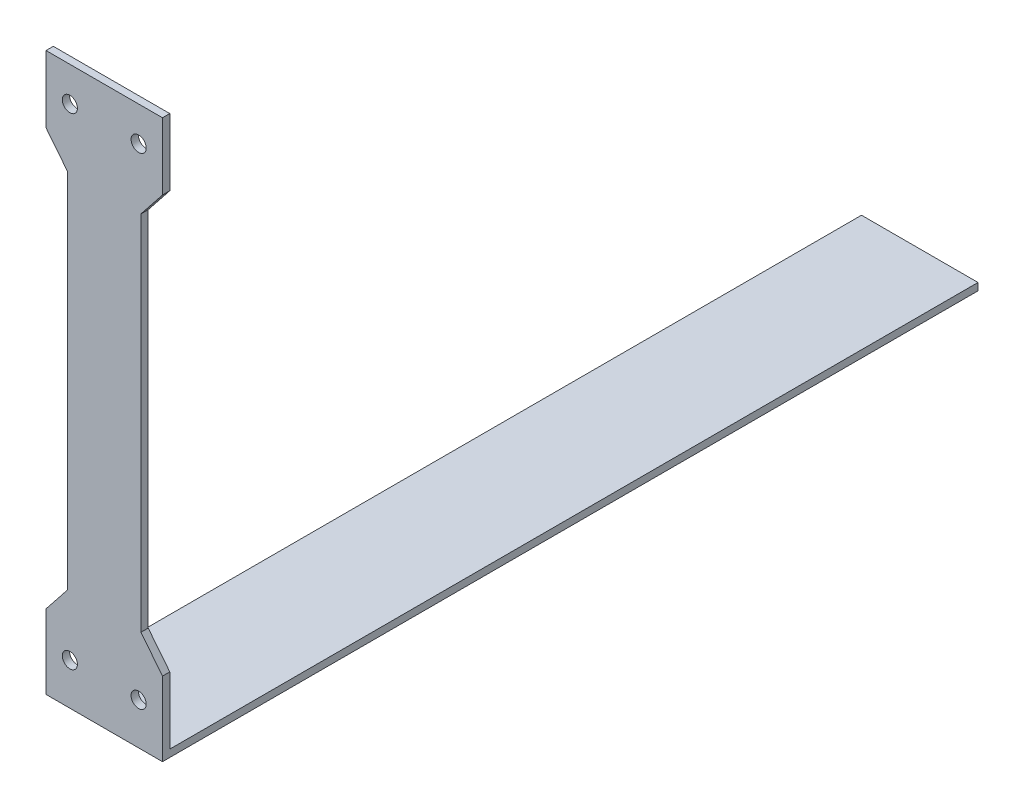
from build123d import *

# Parameters (mm, degrees)
BOSS_EXTRUDE1_DEPTH = 1.5875
SKETCH2_W           = 25.4
SKETCH2_H           = 177.8
BOSS_EXTRUDE2_DEPTH = 1.5875


with BuildPart() as part:
    # Sketch1 → Boss-Extrude1 (new body)
    with BuildSketch(Plane.XY):
        Polygon((-117, 20.5), (-117, 99.5), (-112.3, 105.418518519), (-112.3, 120), (-137.7, 120), (-137.7, 105.418518519), (-133, 99.5), (-133, 20.5), (-137.7, 14.581481481), (-137.7, 0), (-112.3, 0), (-112.3, 14.581481481), align=None)
        with BuildLine():
            ThreePointArc((-130.85, 7.5), (-132.5, 5.85), (-134.15, 7.5))
            ThreePointArc((-134.15, 7.5), (-132.5, 9.15), (-130.85, 7.5))
        make_face(mode=Mode.SUBTRACT)
        with BuildLine():
            ThreePointArc((-119.15, 7.5), (-117.5, 9.15), (-115.85, 7.5))
            ThreePointArc((-115.85, 7.5), (-117.5, 5.85), (-119.15, 7.5))
        make_face(mode=Mode.SUBTRACT)
        with BuildLine():
            ThreePointArc((-130.85, 112.5), (-132.5, 110.85), (-134.15, 112.5))
            ThreePointArc((-134.15, 112.5), (-132.5, 114.15), (-130.85, 112.5))
        make_face(mode=Mode.SUBTRACT)
        with BuildLine():
            ThreePointArc((-115.85, 112.5), (-117.5, 110.85), (-119.15, 112.5))
            ThreePointArc((-119.15, 112.5), (-117.5, 114.15), (-115.85, 112.5))
        make_face(mode=Mode.SUBTRACT)
    extrude(amount=BOSS_EXTRUDE1_DEPTH)

    # Sketch2 → Boss-Extrude2 (add)
    with BuildSketch(Plane(origin=(0, 0, 0), x_dir=(1, 0, 0), z_dir=(0, 1, 0))):
        with Locations((-125, 87.3125)):
            Rectangle(SKETCH2_W, SKETCH2_H)
    extrude(amount=-BOSS_EXTRUDE2_DEPTH)


solid = part.part
